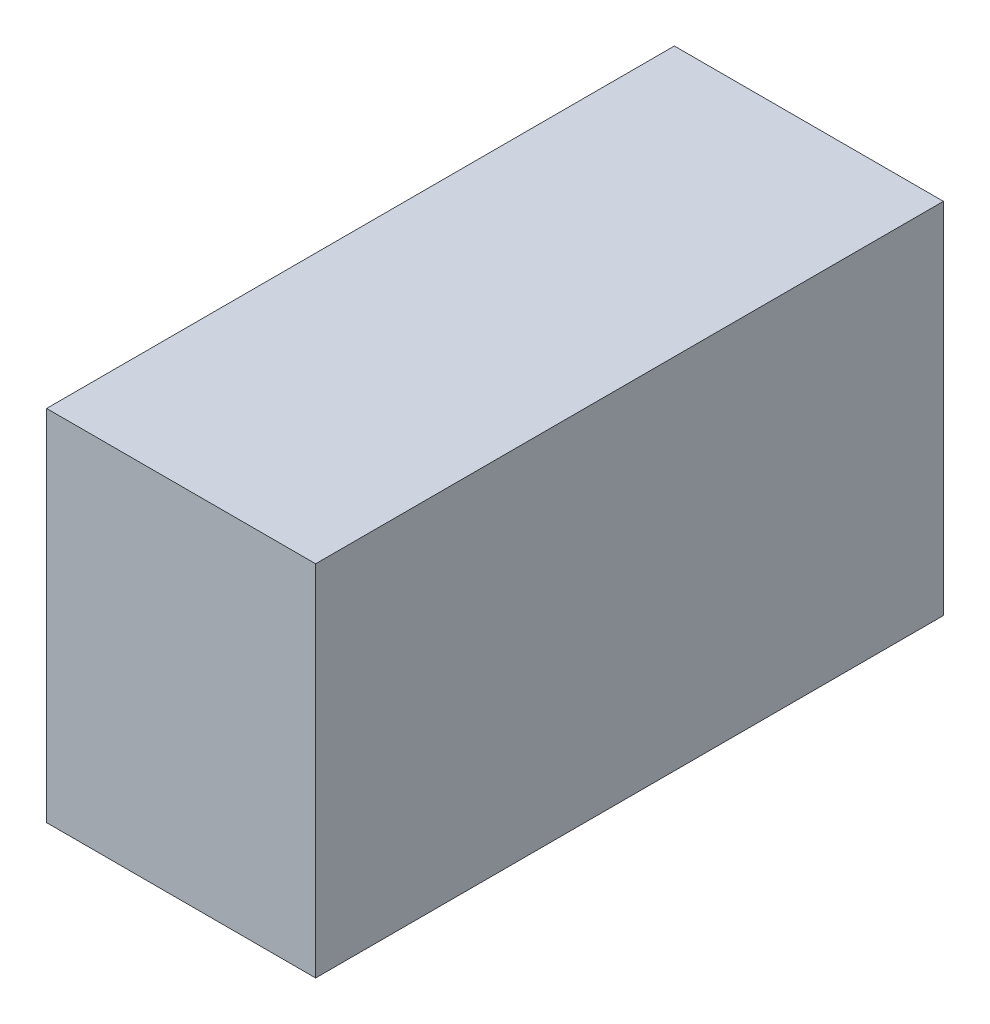
from build123d import *

# Parameters (mm, degrees)
SKETCH1_W           = 38.1
SKETCH1_H           = 88.9
BOSS_EXTRUDE1_DEPTH = 50.8


with BuildPart() as part:
    # Sketch1 → Boss-Extrude1 (new body)
    with BuildSketch(Plane(origin=(0, 0, 0), x_dir=(1, 0, 0), z_dir=(0, 1, 0))):
        with Locations((19.05, 44.45)):
            Rectangle(SKETCH1_W, SKETCH1_H)
    extrude(amount=BOSS_EXTRUDE1_DEPTH)


solid = part.part
